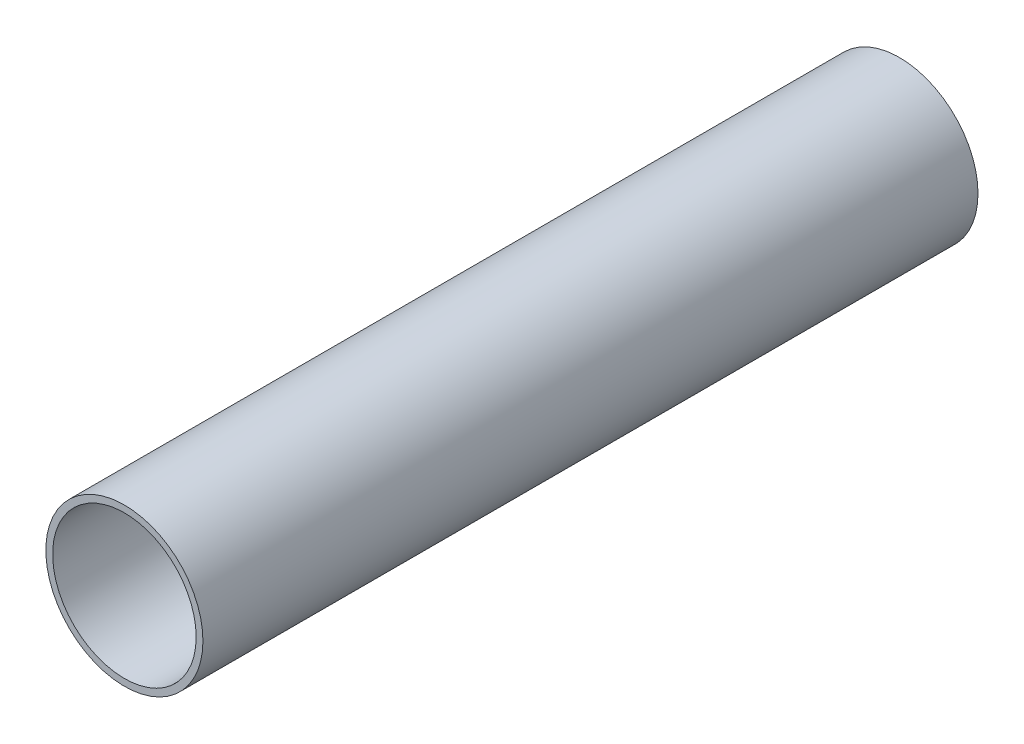
from build123d import *

# Parameters (mm, degrees)
SKETCH1_R           = 17.375
SKETCH1_R_2         = 15.875
BOSS_EXTRUDE1_DEPTH = 85.725


with BuildPart() as part:
    # Sketch1 → Boss-Extrude1 (new, symmetric)
    with BuildSketch(Plane.XY):
        Circle(SKETCH1_R)
        Circle(SKETCH1_R_2, mode=Mode.SUBTRACT)
    extrude(amount=BOSS_EXTRUDE1_DEPTH, both=True)


solid = part.part
